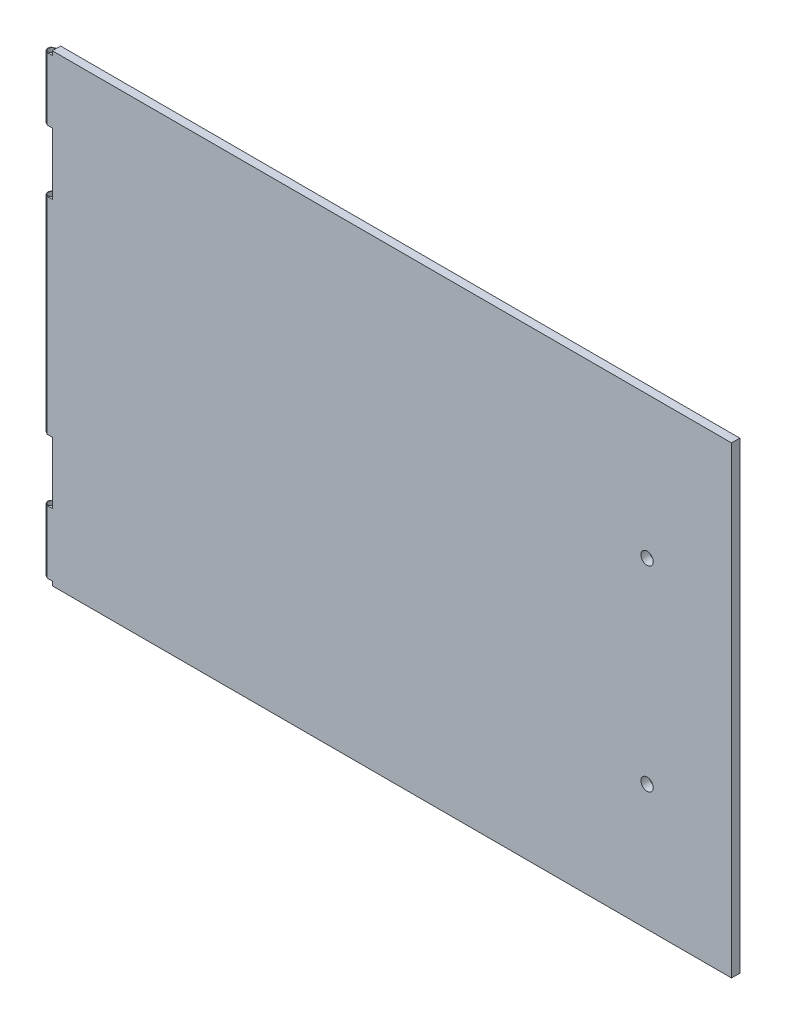
from build123d import *

# Parameters (mm, degrees)
SKETCH2_W           = 334
SKETCH2_H           = 225
BOSS_EXTRUDE1_DEPTH = 2
SKETCH3_R           = 1.5
CUT_EXTRUDE1_DEPTH  = 403.721988473
SKETCH4_W           = 4.25
SKETCH4_H           = 30
CUT_EXTRUDE2_DEPTH  = 403.736886813
SKETCH5_W           = 4.25
SKETCH5_H           = 2
CUT_EXTRUDE3_DEPTH  = 403.736886813
SKETCH6_R           = 3
CUT_EXTRUDE4_DEPTH  = 10


with BuildPart() as part:
    # Sketch2 → Boss-Extrude1 (new, symmetric)
    with BuildSketch(Plane.XY):
        with Locations((167, 112.5)):
            Rectangle(SKETCH2_W, SKETCH2_H)
    extrude(amount=BOSS_EXTRUDE1_DEPTH, both=True)

    # Sketch3 → Cut-Extrude1 (cut, through all)
    with BuildSketch(Plane(origin=(0, 225, 0), x_dir=(1, 0, 0), z_dir=(0, 1, 0))):
        with BuildLine():
            ThreePointArc((0, 0), (0.512563133, 1.237436867), (1.75, 1.75))
            Line((1.75, 1.75), (1.75, 2))
            Line((1.75, 2), (0, 2))
            Line((0, 2), (0, 0))
        make_face()
        with BuildLine():
            ThreePointArc((1.75, -1.75), (0.512563133, -1.237436867), (0, 0))
            Line((0, 0), (0, -2))
            Line((0, -2), (1.75, -2))
            Line((1.75, -2), (1.75, -1.75))
        make_face()
        with Locations(Location((1.75, 0, 0), (0, 0, 270))):
            Circle(SKETCH3_R)
    extrude(amount=-CUT_EXTRUDE1_DEPTH, mode=Mode.SUBTRACT)

    # Sketch4 → Cut-Extrude2 (cut, through all)
    with BuildSketch(Plane.XY.offset(2)):
        with Locations((2.125, 177.5)):
            Rectangle(SKETCH4_W, SKETCH4_H)
        with Locations((2.125, 47.5)):
            Rectangle(SKETCH4_W, SKETCH4_H)
    extrude(amount=-CUT_EXTRUDE2_DEPTH, mode=Mode.SUBTRACT)

    # Sketch5 → Cut-Extrude3 (cut, through all)
    with BuildSketch(Plane.XY.offset(2)):
        with Locations((2.125, 224)):
            Rectangle(SKETCH5_W, SKETCH5_H)
        with Locations((2.125, 1)):
            Rectangle(SKETCH5_W, SKETCH5_H)
    extrude(amount=-CUT_EXTRUDE3_DEPTH, mode=Mode.SUBTRACT)

    # Sketch6 → Cut-Extrude4 (cut)
    with BuildSketch(Plane.XY.offset(2)):
        with Locations((293, 155.999999999)):
            Circle(SKETCH6_R)
        with Locations((293, 60.999999999)):
            Circle(SKETCH6_R)
    extrude(amount=-CUT_EXTRUDE4_DEPTH, mode=Mode.SUBTRACT)


solid = part.part
